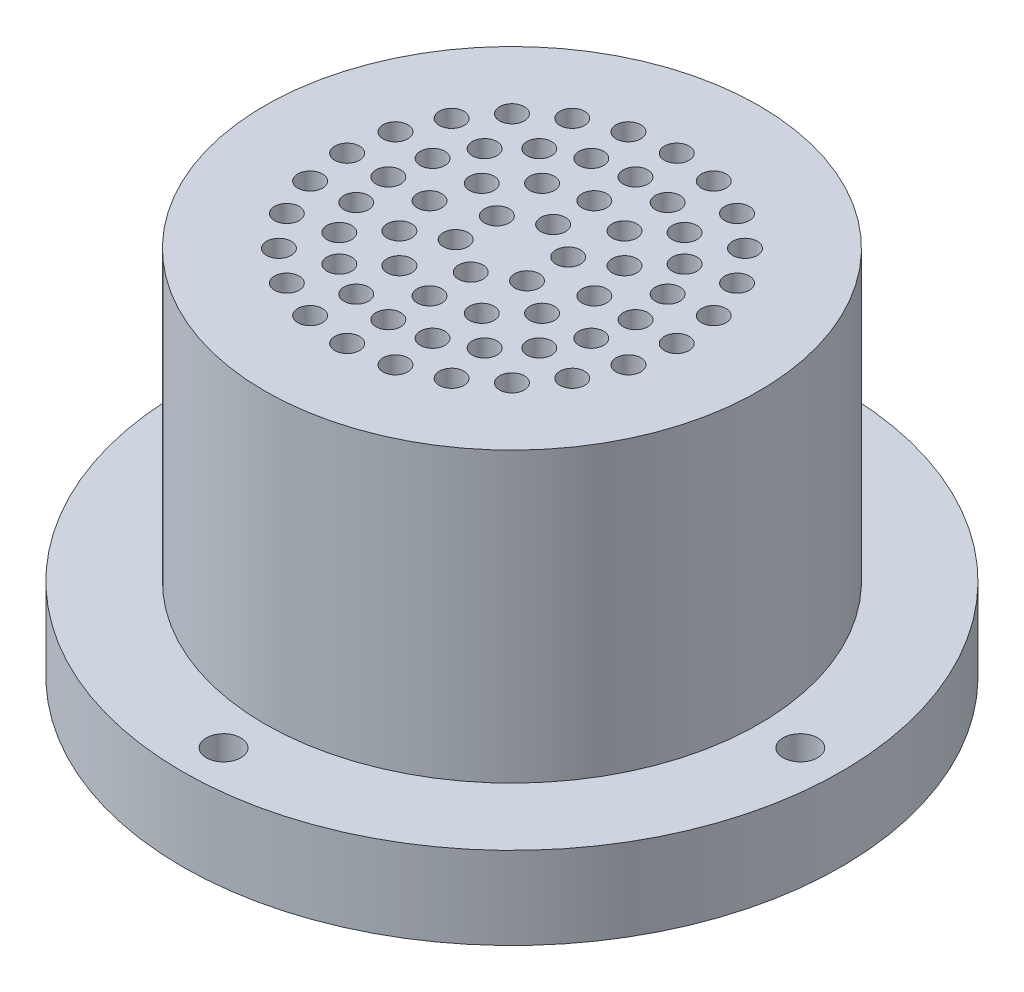
from build123d import *

# Parameters (mm, degrees)
SKETCH2_R           = 40
SKETCH2_R_2         = 25
SKETCH2_R_3         = 2.1
BOSS_EXTRUDE1_DEPTH = 10
SKETCH4_R           = 30
SKETCH4_R_2         = 25
BOSS_EXTRUDE2_DEPTH = 30
SKETCH5_R           = 30
SKETCH5_R_2         = 1.5
BOSS_EXTRUDE3_DEPTH = 5


with BuildPart() as part:
    # Sketch2 → Boss-Extrude1 (new body)
    with BuildSketch(Plane(origin=(0, 0, 0), x_dir=(1, 0, 0), z_dir=(0, 1, 0))):
        with Locations(Location((0, 0, 0), (0, 0, 270))):
            Circle(SKETCH2_R)
        with Locations(Location((0, 0, 0), (0, 0, 270))):
            Circle(SKETCH2_R_2, mode=Mode.SUBTRACT)
        with Locations(Location((35, 0, 0), (0, 0, 270))):
            Circle(SKETCH2_R_3, mode=Mode.SUBTRACT)
        with Locations(Location((0, -35, 0), (0, 0, 270))):
            Circle(SKETCH2_R_3, mode=Mode.SUBTRACT)
        with Locations(Location((-35, 0, 0), (0, 0, 270))):
            Circle(SKETCH2_R_3, mode=Mode.SUBTRACT)
        with Locations(Location((0, 35, 0), (0, 0, 270))):
            Circle(SKETCH2_R_3, mode=Mode.SUBTRACT)
    extrude(amount=BOSS_EXTRUDE1_DEPTH)

    # Sketch4 → Boss-Extrude2 (add)
    with BuildSketch(Plane(origin=(0, 10, 0), x_dir=(1, 0, 0), z_dir=(0, 1, 0))):
        with Locations(Location((0, 0, 0), (0, 0, 270))):
            Circle(SKETCH4_R)
        with Locations(Location((0, 0, 0), (0, 0, 270))):
            Circle(SKETCH4_R_2, mode=Mode.SUBTRACT)
    extrude(amount=BOSS_EXTRUDE2_DEPTH)

    # Sketch5 → Boss-Extrude3 (add)
    with BuildSketch(Plane(origin=(0, 40, 0), x_dir=(1, 0, 0), z_dir=(0, 1, 0))):
        with Locations(Location((0, 0, 0), (0, 0, 270))):
            Circle(SKETCH5_R)
        with Locations(Location((0, 5, 0), (0, 0, 270))):
            Circle(SKETCH5_R_2, mode=Mode.SUBTRACT)
        with Locations(Location((0, 10, 0), (0, 0, 270))):
            Circle(SKETCH5_R_2, mode=Mode.SUBTRACT)
        with Locations(Location((0, 15, 0), (0, 0, 270))):
            Circle(SKETCH5_R_2, mode=Mode.SUBTRACT)
        with Locations(Location((0, 20, 0), (0, 0, 270))):
            Circle(SKETCH5_R_2, mode=Mode.SUBTRACT)
        with Locations(Location((4.330127019, 2.5, 0), (0, 0, 270))):
            Circle(SKETCH5_R_2, mode=Mode.SUBTRACT)
        with Locations(Location((4.330127019, -2.5, 0), (0, 0, 270))):
            Circle(SKETCH5_R_2, mode=Mode.SUBTRACT)
        with Locations(Location((0, -5, 0), (0, 0, 270))):
            Circle(SKETCH5_R_2, mode=Mode.SUBTRACT)
        with Locations(Location((-4.330127019, -2.5, 0), (0, 0, 270))):
            Circle(SKETCH5_R_2, mode=Mode.SUBTRACT)
        with Locations(Location((-4.330127019, 2.5, 0), (0, 0, 270))):
            Circle(SKETCH5_R_2, mode=Mode.SUBTRACT)
        with Locations(Location((5, 8.660254038, 0), (0, 0, 270))):
            Circle(SKETCH5_R_2, mode=Mode.SUBTRACT)
        with Locations(Location((8.660254038, 5, 0), (0, 0, 270))):
            Circle(SKETCH5_R_2, mode=Mode.SUBTRACT)
        with Locations(Location((10, 0, 0), (0, 0, 270))):
            Circle(SKETCH5_R_2, mode=Mode.SUBTRACT)
        with Locations(Location((8.660254038, -5, 0), (0, 0, 270))):
            Circle(SKETCH5_R_2, mode=Mode.SUBTRACT)
        with Locations(Location((5, -8.660254038, 0), (0, 0, 270))):
            Circle(SKETCH5_R_2, mode=Mode.SUBTRACT)
        with Locations(Location((0, -10, 0), (0, 0, 270))):
            Circle(SKETCH5_R_2, mode=Mode.SUBTRACT)
        with Locations(Location((-5, -8.660254038, 0), (0, 0, 270))):
            Circle(SKETCH5_R_2, mode=Mode.SUBTRACT)
        with Locations(Location((-8.660254038, -5, 0), (0, 0, 270))):
            Circle(SKETCH5_R_2, mode=Mode.SUBTRACT)
        with Locations(Location((-10, 0, 0), (0, 0, 270))):
            Circle(SKETCH5_R_2, mode=Mode.SUBTRACT)
        with Locations(Location((-8.660254038, 5, 0), (0, 0, 270))):
            Circle(SKETCH5_R_2, mode=Mode.SUBTRACT)
        with Locations(Location((-5, 8.660254038, 0), (0, 0, 270))):
            Circle(SKETCH5_R_2, mode=Mode.SUBTRACT)
        with Locations(Location((4.635254916, 14.265847744, 0), (0, 0, 270))):
            Circle(SKETCH5_R_2, mode=Mode.SUBTRACT)
        with Locations(Location((8.816778784, 12.135254916, 0), (0, 0, 270))):
            Circle(SKETCH5_R_2, mode=Mode.SUBTRACT)
        with Locations(Location((12.135254916, 8.816778784, 0), (0, 0, 270))):
            Circle(SKETCH5_R_2, mode=Mode.SUBTRACT)
        with Locations(Location((14.265847744, 4.635254916, 0), (0, 0, 270))):
            Circle(SKETCH5_R_2, mode=Mode.SUBTRACT)
        with Locations(Location((15, 0, 0), (0, 0, 270))):
            Circle(SKETCH5_R_2, mode=Mode.SUBTRACT)
        with Locations(Location((14.265847744, -4.635254916, 0), (0, 0, 270))):
            Circle(SKETCH5_R_2, mode=Mode.SUBTRACT)
        with Locations(Location((12.135254916, -8.816778784, 0), (0, 0, 270))):
            Circle(SKETCH5_R_2, mode=Mode.SUBTRACT)
        with Locations(Location((8.816778784, -12.135254916, 0), (0, 0, 270))):
            Circle(SKETCH5_R_2, mode=Mode.SUBTRACT)
        with Locations(Location((4.635254916, -14.265847744, 0), (0, 0, 270))):
            Circle(SKETCH5_R_2, mode=Mode.SUBTRACT)
        with Locations(Location((0, -15, 0), (0, 0, 270))):
            Circle(SKETCH5_R_2, mode=Mode.SUBTRACT)
        with Locations(Location((-4.635254916, -14.265847744, 0), (0, 0, 270))):
            Circle(SKETCH5_R_2, mode=Mode.SUBTRACT)
        with Locations(Location((-8.816778784, -12.135254916, 0), (0, 0, 270))):
            Circle(SKETCH5_R_2, mode=Mode.SUBTRACT)
        with Locations(Location((-12.135254916, -8.816778784, 0), (0, 0, 270))):
            Circle(SKETCH5_R_2, mode=Mode.SUBTRACT)
        with Locations(Location((-14.265847744, -4.635254916, 0), (0, 0, 270))):
            Circle(SKETCH5_R_2, mode=Mode.SUBTRACT)
        with Locations(Location((-15, 0, 0), (0, 0, 270))):
            Circle(SKETCH5_R_2, mode=Mode.SUBTRACT)
        with Locations(Location((-14.265847744, 4.635254916, 0), (0, 0, 270))):
            Circle(SKETCH5_R_2, mode=Mode.SUBTRACT)
        with Locations(Location((-12.135254916, 8.816778784, 0), (0, 0, 270))):
            Circle(SKETCH5_R_2, mode=Mode.SUBTRACT)
        with Locations(Location((-8.816778784, 12.135254916, 0), (0, 0, 270))):
            Circle(SKETCH5_R_2, mode=Mode.SUBTRACT)
        with Locations(Location((-4.635254916, 14.265847744, 0), (0, 0, 270))):
            Circle(SKETCH5_R_2, mode=Mode.SUBTRACT)
        with Locations(Location((5.176380902, 19.318516526, 0), (0, 0, 270))):
            Circle(SKETCH5_R_2, mode=Mode.SUBTRACT)
        with Locations(Location((10, 17.320508076, 0), (0, 0, 270))):
            Circle(SKETCH5_R_2, mode=Mode.SUBTRACT)
        with Locations(Location((14.142135624, 14.142135624, 0), (0, 0, 270))):
            Circle(SKETCH5_R_2, mode=Mode.SUBTRACT)
        with Locations(Location((17.320508076, 10, 0), (0, 0, 270))):
            Circle(SKETCH5_R_2, mode=Mode.SUBTRACT)
        with Locations(Location((19.318516526, 5.176380902, 0), (0, 0, 270))):
            Circle(SKETCH5_R_2, mode=Mode.SUBTRACT)
        with Locations(Location((20, 0, 0), (0, 0, 270))):
            Circle(SKETCH5_R_2, mode=Mode.SUBTRACT)
        with Locations(Location((19.318516526, -5.176380902, 0), (0, 0, 270))):
            Circle(SKETCH5_R_2, mode=Mode.SUBTRACT)
        with Locations(Location((17.320508076, -10, 0), (0, 0, 270))):
            Circle(SKETCH5_R_2, mode=Mode.SUBTRACT)
        with Locations(Location((14.142135624, -14.142135624, 0), (0, 0, 270))):
            Circle(SKETCH5_R_2, mode=Mode.SUBTRACT)
        with Locations(Location((10, -17.320508076, 0), (0, 0, 270))):
            Circle(SKETCH5_R_2, mode=Mode.SUBTRACT)
        with Locations(Location((5.176380902, -19.318516526, 0), (0, 0, 270))):
            Circle(SKETCH5_R_2, mode=Mode.SUBTRACT)
        with Locations(Location((0, -20, 0), (0, 0, 270))):
            Circle(SKETCH5_R_2, mode=Mode.SUBTRACT)
        with Locations(Location((-5.176380902, -19.318516526, 0), (0, 0, 270))):
            Circle(SKETCH5_R_2, mode=Mode.SUBTRACT)
        with Locations(Location((-10, -17.320508076, 0), (0, 0, 270))):
            Circle(SKETCH5_R_2, mode=Mode.SUBTRACT)
        with Locations(Location((-14.142135624, -14.142135624, 0), (0, 0, 270))):
            Circle(SKETCH5_R_2, mode=Mode.SUBTRACT)
        with Locations(Location((-17.320508076, -10, 0), (0, 0, 270))):
            Circle(SKETCH5_R_2, mode=Mode.SUBTRACT)
        with Locations(Location((-19.318516526, -5.176380902, 0), (0, 0, 270))):
            Circle(SKETCH5_R_2, mode=Mode.SUBTRACT)
        with Locations(Location((-20, 0, 0), (0, 0, 270))):
            Circle(SKETCH5_R_2, mode=Mode.SUBTRACT)
        with Locations(Location((-19.318516526, 5.176380902, 0), (0, 0, 270))):
            Circle(SKETCH5_R_2, mode=Mode.SUBTRACT)
        with Locations(Location((-17.320508076, 10, 0), (0, 0, 270))):
            Circle(SKETCH5_R_2, mode=Mode.SUBTRACT)
        with Locations(Location((-14.142135624, 14.142135624, 0), (0, 0, 270))):
            Circle(SKETCH5_R_2, mode=Mode.SUBTRACT)
        with Locations(Location((-10, 17.320508076, 0), (0, 0, 270))):
            Circle(SKETCH5_R_2, mode=Mode.SUBTRACT)
        with Locations(Location((-5.176380902, 19.318516526, 0), (0, 0, 270))):
            Circle(SKETCH5_R_2, mode=Mode.SUBTRACT)
    extrude(amount=BOSS_EXTRUDE3_DEPTH)


solid = part.part
